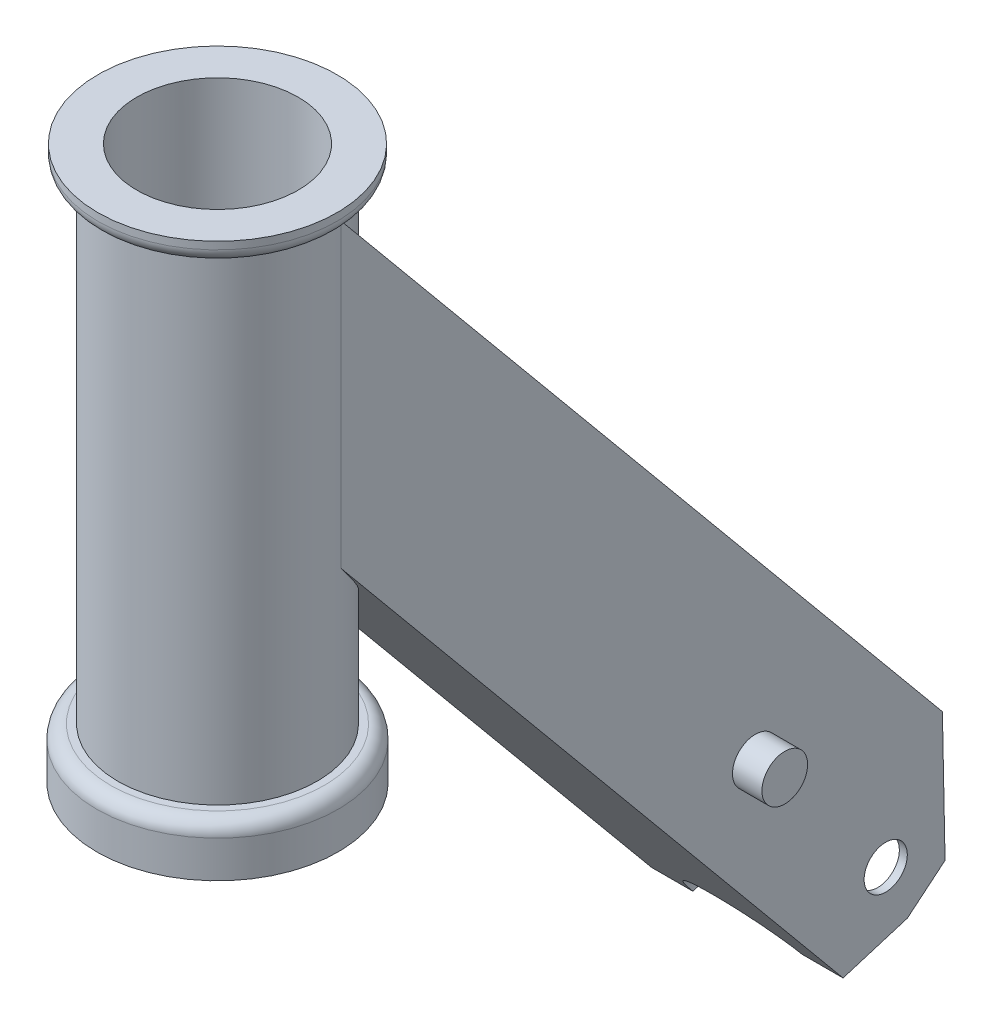
from build123d import *

# Parameters (mm, degrees)
SKETCH4_R           = 3.96875
BOSS_EXTRUDE1_DEPTH = 17.5895
SKETCH5_W           = 32.258
SKETCH5_H           = 32.3469
CUT_EXTRUDE1_DEPTH  = 149.479
CUT_EXTRUDE2_REACH  = 137.398
CUT_EXTRUDE3_REACH  = 133.417
SKETCH8_R           = 4.19735
BOSS_EXTRUDE2_DEPTH = 5.4102
SKETCH9_R           = 14.8209
CUT_EXTRUDE4_DEPTH  = 156.952637313


with BuildPart() as part:
    # Sketch3 → Revolve1 (revolve)
    with BuildSketch(Plane.XY, mode=Mode.PRIVATE) as revolve1_sk:
        with BuildLine():
            Line((0, 0), (22.1742, 0))
            Line((22.1742, 0), (22.1742, 6.7818))
            ThreePointArc((22.1742, 6.7818), (21.430251224, 8.577851224), (19.6342, 9.3218))
            Line((19.6342, 9.3218), (18.3134, 9.3218))
            Line((18.3134, 9.3218), (18.3134, 97.6884))
            Line((18.3134, 97.6884), (19.431, 97.6884))
            ThreePointArc((19.431, 97.6884), (21.227051224, 98.432348776), (21.971, 100.2284))
            Line((21.971, 100.2284), (21.971, 101.6))
            Line((21.971, 101.6), (0, 101.6))
            Line((0, 101.6), (0, 0))
        make_face()
    revolve(revolve1_sk.sketch.rotate(Axis((0, 101.6, 0), (0, -1, 0)), 90), axis=Axis((0, 101.6, 0), (0, -1, 0)))

    # Sketch4 → Boss-Extrude1 (add, symmetric)
    with BuildSketch(Plane(origin=(0, 0, 0), x_dir=(0, 0, -1), z_dir=(1, 0, 0))):
        Polygon((3.319704812, 97.6884), (115.572791881, -37.744541555), (116.058945734, -61.655625383), (109.136154682, -67.393554854), (97.331039415, -71.002358659), (0, 46.427186637), align=None)
        with Locations((105.157137902, -57.289139694)):
            Circle(SKETCH4_R, mode=Mode.SUBTRACT)
    extrude(amount=BOSS_EXTRUDE1_DEPTH, both=True)

    # Sketch5 → Cut-Extrude1 (cut)
    with BuildSketch(Plane(origin=(0, -93.569618845, -77.554828616), x_dir=(1, 0, 0), z_dir=(0, -0.7699175955046751, -0.6381433194293421))):
        with Locations((0, -47.261148993)):
            Rectangle(SKETCH5_W, SKETCH5_H)
    extrude(amount=-CUT_EXTRUDE1_DEPTH, mode=Mode.SUBTRACT)

    # Sketch6 → Cut-Extrude2 (cut, up to next)
    with BuildSketch(Plane(origin=(0, 41.412373886, -49.963878576), x_dir=(-1, 0, 0), z_dir=(0, 0.6381433194293402, -0.7699175955046768)), mode=Mode.PRIVATE) as cut_extrude2_sk1:
        with BuildLine():
            Line((14.9225, -97.744891724), (14.9225, -112.907394914))
            Line((14.9225, -112.907394914), (-14.9225, -112.907394914))
            Line((-14.9225, -112.907394914), (-14.9225, -97.744891724))
            ThreePointArc((-14.9225, -97.744891724), (0, -82.822391724), (14.9225, -97.744891724))
        make_face()
    cut_extrude2_tool1 = extrude(cut_extrude2_sk1.sketch, amount=-CUT_EXTRUDE2_REACH, mode=Mode.PRIVATE) & part.part
    add(cut_extrude2_tool1.solids().sort_by_distance((0, -35.009466, -113.305835))[0], mode=Mode.SUBTRACT)

    # Sketch7 → Cut-Extrude3 (cut, up to next)
    with BuildSketch(Plane(origin=(0, 18.906399111, -22.81050181), x_dir=(1, 0, 0), z_dir=(0, -0.6381433194293403, 0.7699175955046769)), mode=Mode.PRIVATE) as cut_extrude3_sk1:
        with BuildLine():
            Line((-9.989016296, -117.386717047), (9.989016296, -117.386717047))
            ThreePointArc((9.989016296, -117.386717047), (0, -106.76951783), (-9.989016296, -117.386717047))
        make_face()
    cut_extrude3_tool1 = extrude(cut_extrude3_sk1.sketch, amount=-CUT_EXTRUDE3_REACH, mode=Mode.PRIVATE) & part.part
    add(cut_extrude3_tool1.solids().sort_by_distance((0, -67.984352, -94.829576))[0], mode=Mode.SUBTRACT)

    # Sketch8 → Boss-Extrude2 (add)
    with BuildSketch(Plane(origin=(17.5895, 0, 0), x_dir=(0, 0, -1), z_dir=(1, 0, 0))):
        with Locations(Location((81.207034429, -28.363574673, 0), (0, 0, 180))):
            Circle(SKETCH8_R)
    boss_extrude2 = extrude(amount=BOSS_EXTRUDE2_DEPTH)

    # Mirror1: Boss-Extrude2 across plane
    add(boss_extrude2.mirror(Plane(origin=(0, 0, 0), x_dir=(0, 0, 1), z_dir=(1, 0, 0))))

    # Sketch9 → Cut-Extrude4 (cut, through all)
    with BuildSketch(Plane.XZ):
        with Locations(Location((0, 0, 0), (0, 0, 270))):
            Circle(SKETCH9_R)
    extrude(amount=-CUT_EXTRUDE4_DEPTH, mode=Mode.SUBTRACT)


solid = part.part
